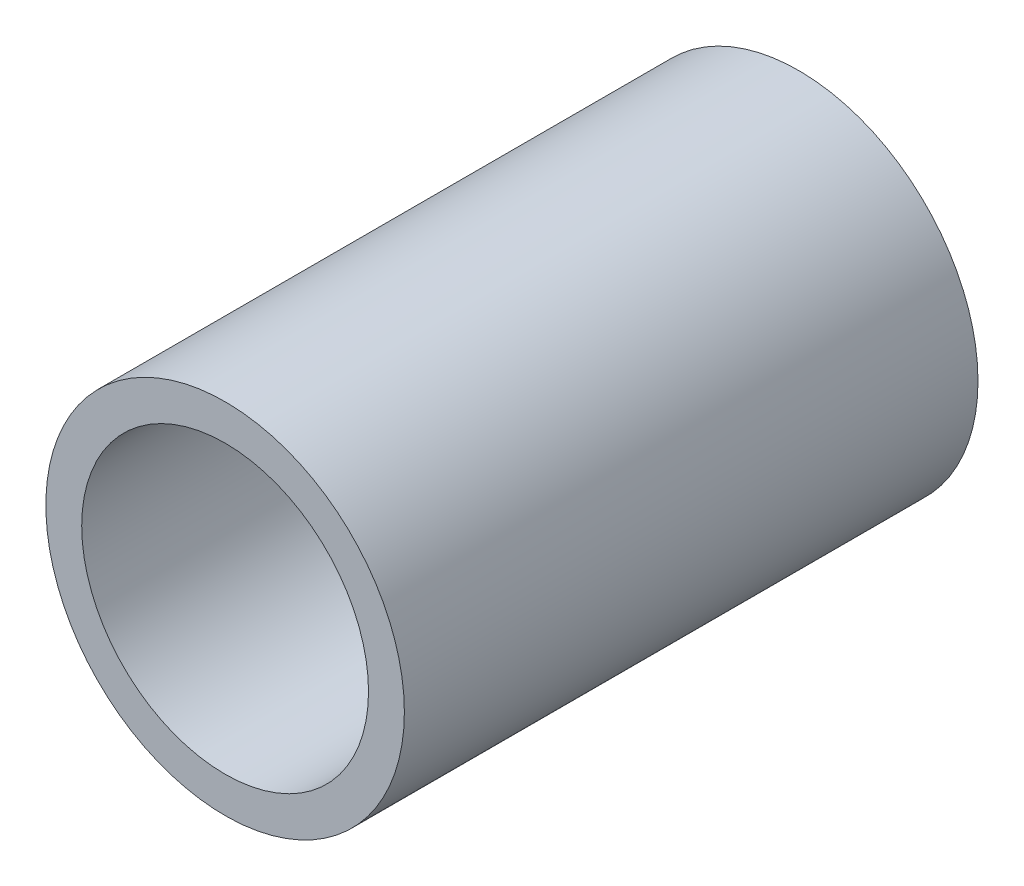
from build123d import *

# Parameters (mm, degrees)
SKETCH1_R           = 7.5
SKETCH1_R_2         = 6
BOSS_EXTRUDE1_DEPTH = 12


with BuildPart() as part:
    # Sketch1 → Boss-Extrude1 (new, symmetric)
    with BuildSketch(Plane(origin=(0, 0, 0), x_dir=(0, 1, 0), z_dir=(0, 0, 1))):
        with Locations(Location((0, 0, 0), (0, 0, 270))):
            Circle(SKETCH1_R)
        with Locations(Location((0, 0, 0), (0, 0, 270))):
            Circle(SKETCH1_R_2, mode=Mode.SUBTRACT)
    extrude(amount=BOSS_EXTRUDE1_DEPTH, both=True)


solid = part.part
